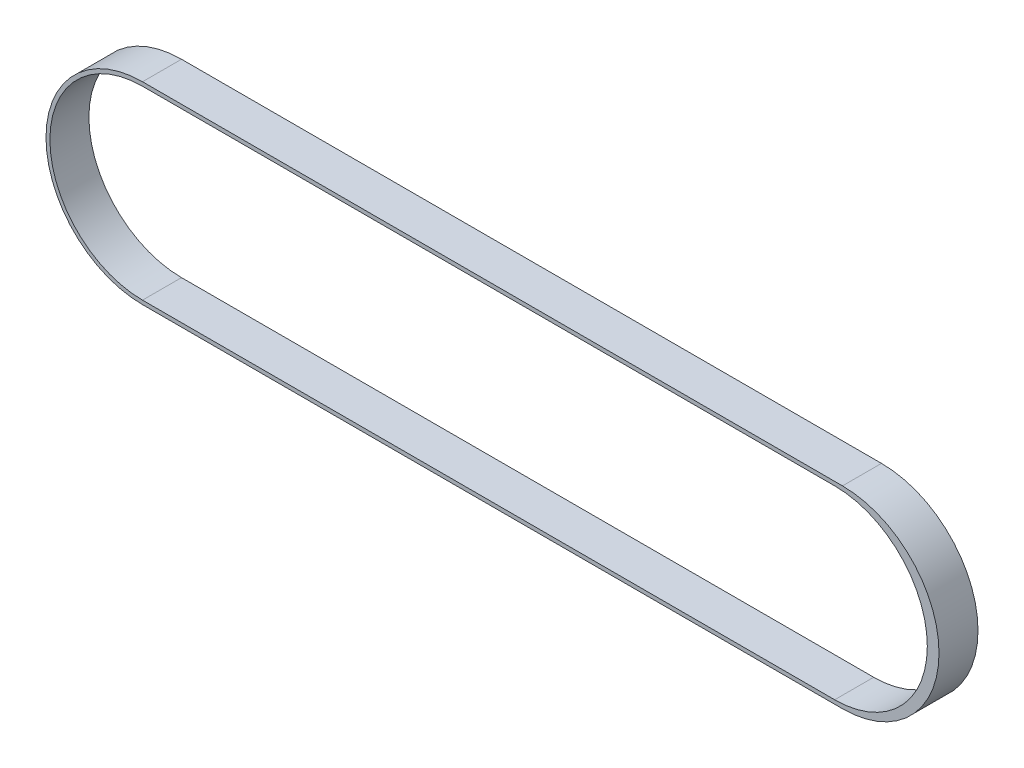
from build123d import *

# Parameters (mm, degrees)
BOSS_EXTRUDE1_DEPTH = 12.7
CUT_EXTRUDE1_DEPTH  = 12.7


with BuildPart() as part:
    # Sketch2 → Boss-Extrude1 (new body)
    with BuildSketch(Plane.XY):
        with BuildLine():
            Line((0, 31.4325), (227.965, 31.4325))
            ThreePointArc((227.965, 31.4325), (259.3975, 0), (227.965, -31.4325))
            Line((227.965, -31.4325), (0, -31.4325))
            ThreePointArc((0, -31.4325), (-31.4325, 0), (0, 31.4325))
        make_face()
    extrude(amount=BOSS_EXTRUDE1_DEPTH)

    # Sketch3 → Cut-Extrude1 (cut)
    with BuildSketch(Plane.XY.offset(12.7)):
        with BuildLine():
            Line((0, 30.1625), (225.425, 30.1625))
            ThreePointArc((225.425, 30.1625), (255.5875, 0), (225.425, -30.1625))
            Line((225.425, -30.1625), (0, -30.1625))
            ThreePointArc((0, -30.1625), (-30.1625, 0), (0, 30.1625))
        make_face()
    extrude(amount=-CUT_EXTRUDE1_DEPTH, mode=Mode.SUBTRACT)


solid = part.part
